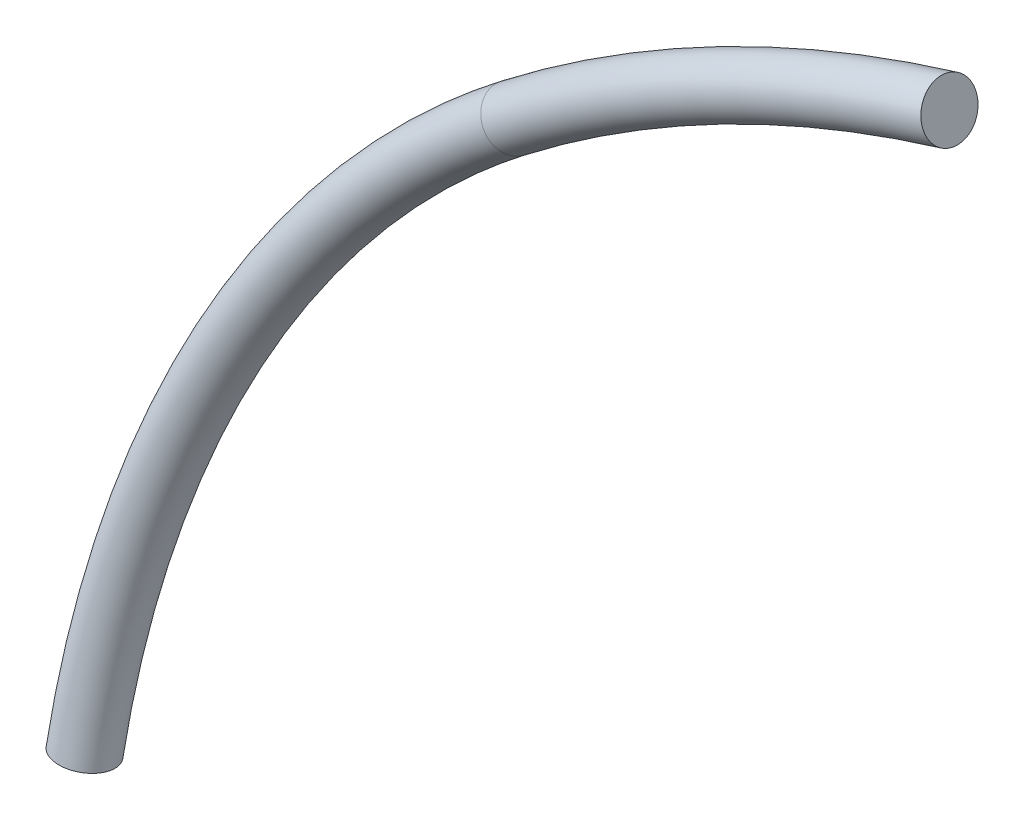
from build123d import *

# Parameters (mm, degrees)
SKETCH4_R = 50.8
SKETCH5_R = 50.800000001


with BuildPart() as part:
    # Sweep1: sweep along a path in Sketch1
    with BuildLine(Plane.XY) as sweep1_path:
        ThreePointArc((2120.770120359, -70.13433514), (1697.728881507, -241.882880827), (1312.528477183, -486.999386236))
    # Sketch4 → Sweep1 (sweep)
    with BuildSketch(Plane(origin=(1921.832616086, 584.250433114, 0), x_dir=(0, 0, 1), z_dir=(-0.9567646839778512, -0.2908630940713561, 0))):
        with Locations((0, -683.955814018)):
            Circle(SKETCH4_R)
    sweep(path=sweep1_path.line)

    # Sweep2: sweep along a path in Sketch3
    with BuildLine(Plane(origin=(22.616066595, -29.307390524, -206.364975317), x_dir=(0.9941646251563757, 0.01438893129070862, 0.10690957274254942), z_dir=(-0.10787069663157066, 0.1397859622968214, 0.9842884727319382))) as sweep2_path:
        ThreePointArc((1297.861980819, -481.141114135), (809.791715094, -1058.414732217), (611.986976452, -1788.024696369))
    # Sketch5 → Sweep2 (sweep)
    with BuildSketch(Plane(origin=(587.101233977, 453.057074271, 0), x_dir=(0, 0, 1), z_dir=(-0.7916841570285102, -0.6109305979487828, 0))):
        with Locations((0, -1187.413505956)):
            Circle(SKETCH5_R)
    sweep(path=sweep2_path.line)


solid = part.part
